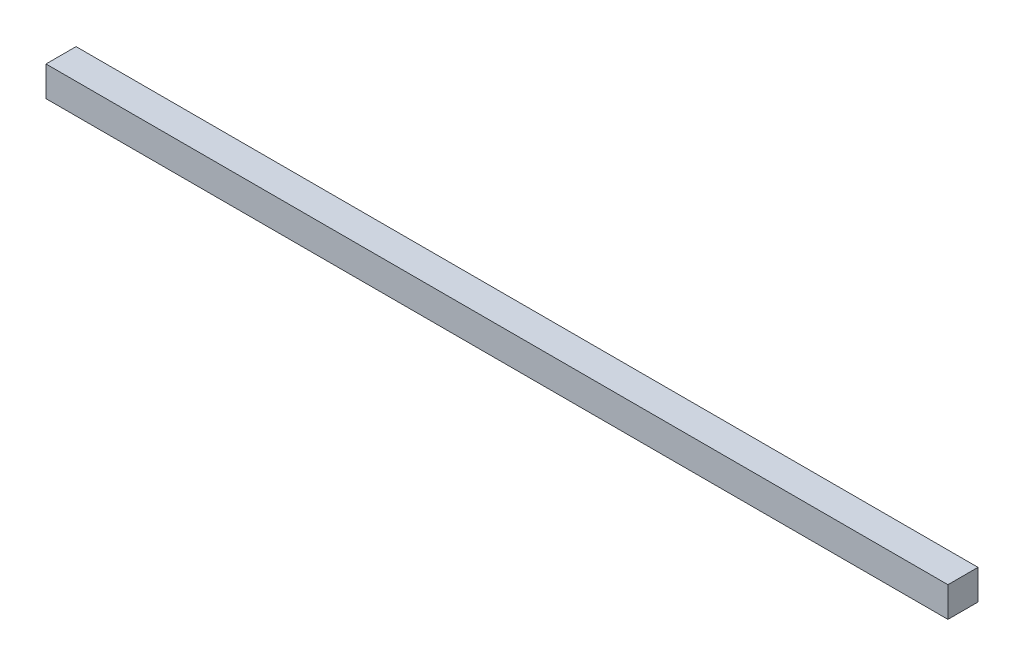
from build123d import *

# Parameters (mm, degrees)
SKETCH1_W           = 25.4
SKETCH1_H           = 25.4
BOSS_EXTRUDE1_DEPTH = 762


with BuildPart() as part:
    # Sketch1 → Boss-Extrude1 (new body)
    with BuildSketch(Plane(origin=(0, 0, 0), x_dir=(0, 0, -1), z_dir=(1, 0, 0))):
        with Locations((12.7, -12.7)):
            Rectangle(SKETCH1_W, SKETCH1_H)
    extrude(amount=BOSS_EXTRUDE1_DEPTH)


solid = part.part
